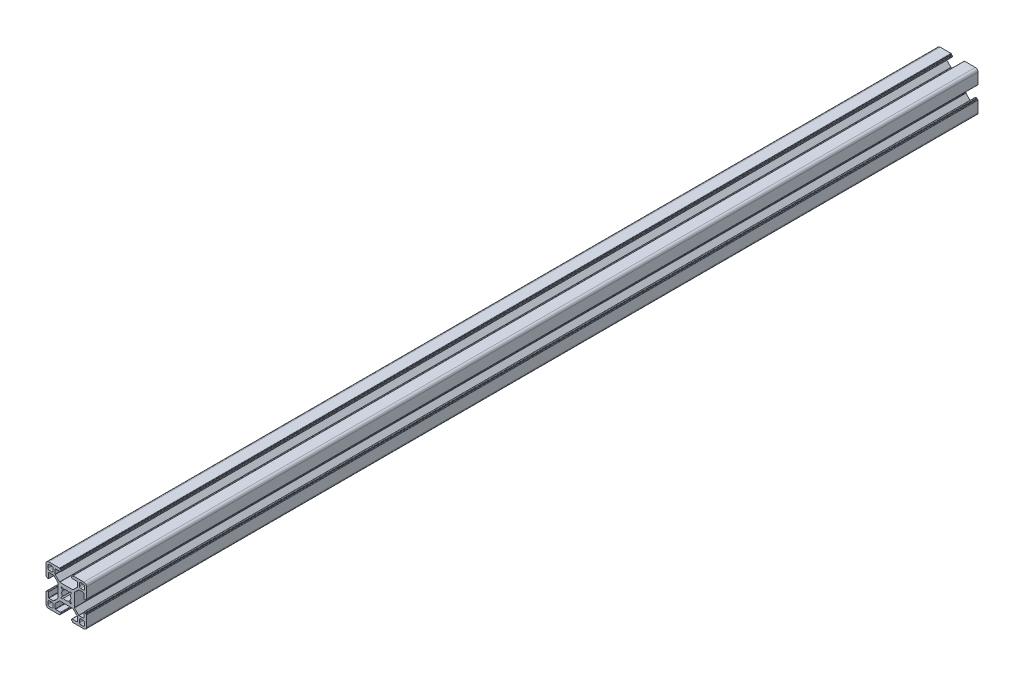
from build123d import *

# Parameters (mm, degrees)
ESTRUSIONE_ESTRUSIONE1_DEPTH = 660


with BuildPart() as part:
    # Schizzo1 → Estrusione-Estrusione1 (new body)
    with BuildSketch(Plane.XY.offset(25)):
        with BuildLine():
            Line((-4.7, -14.7), (-4.7, -14.6))
            ThreePointArc((-4.7, -14.6), (-4.612132034, -14.387867966), (-4.4, -14.3))
            Line((-4.4, -14.3), (-4.3, -14.3))
            ThreePointArc((-4.3, -14.3), (-4.087867966, -14.212132034), (-4, -14))
            Line((-4, -14), (-4, -13.3))
            ThreePointArc((-4, -13.3), (-4.087867966, -13.087867966), (-4.3, -13))
            Line((-4.3, -13), (-7.95, -13))
            ThreePointArc((-7.95, -13), (-8.162132034, -12.912132034), (-8.25, -12.7))
            Line((-8.25, -12.7), (-8.25, -9.43492424))
            ThreePointArc((-8.25, -9.43492424), (-8.22716386, -9.320119211), (-8.162132034, -9.222792206))
            Line((-8.162132034, -9.222792206), (-5.027207794, -6.087867966))
            ThreePointArc((-5.027207794, -6.087867966), (-4.929880789, -6.02283614), (-4.81507576, -6))
            Line((-4.81507576, -6), (4.81507576, -6))
            ThreePointArc((4.81507576, -6), (4.929880789, -6.02283614), (5.027207794, -6.087867966))
            Line((5.027207794, -6.087867966), (8.162132034, -9.222792206))
            ThreePointArc((8.162132034, -9.222792206), (8.22716386, -9.320119211), (8.25, -9.43492424))
            Line((8.25, -9.43492424), (8.25, -12.7))
            ThreePointArc((8.25, -12.7), (8.162132034, -12.912132034), (7.95, -13))
            Line((7.95, -13), (4.3, -13))
            ThreePointArc((4.3, -13), (4.087867966, -13.087867966), (4, -13.3))
            Line((4, -13.3), (4, -14))
            ThreePointArc((4, -14), (4.087867966, -14.212132034), (4.3, -14.3))
            Line((4.3, -14.3), (4.4, -14.3))
            ThreePointArc((4.4, -14.3), (4.612132034, -14.387867966), (4.7, -14.6))
            Line((4.7, -14.6), (4.7, -14.7))
            ThreePointArc((4.7, -14.7), (4.787867966, -14.912132034), (5, -15))
            Line((5, -15), (13, -15))
            ThreePointArc((13, -15), (14.414213562, -14.414213562), (15, -13))
            Line((15, -13), (15, -5))
            ThreePointArc((15, -5), (14.912132034, -4.787867966), (14.7, -4.7))
            Line((14.7, -4.7), (14.6, -4.7))
            ThreePointArc((14.6, -4.7), (14.387867966, -4.612132034), (14.3, -4.4))
            Line((14.3, -4.4), (14.3, -4.3))
            ThreePointArc((14.3, -4.3), (14.212132034, -4.087867966), (14, -4))
            Line((14, -4), (13.3, -4))
            ThreePointArc((13.3, -4), (13.087867966, -4.087867966), (13, -4.3))
            Line((13, -4.3), (13, -7.95))
            ThreePointArc((13, -7.95), (12.912132034, -8.162132034), (12.7, -8.25))
            Line((12.7, -8.25), (9.43492424, -8.25))
            ThreePointArc((9.43492424, -8.25), (9.320119211, -8.22716386), (9.222792206, -8.162132034))
            Line((9.222792206, -8.162132034), (6.087867966, -5.027207794))
            ThreePointArc((6.087867966, -5.027207794), (6.02283614, -4.929880789), (6, -4.81507576))
            Line((6, -4.81507576), (6, 4.81507576))
            ThreePointArc((6, 4.81507576), (6.02283614, 4.929880789), (6.087867966, 5.027207794))
            Line((6.087867966, 5.027207794), (9.222792206, 8.162132034))
            ThreePointArc((9.222792206, 8.162132034), (9.320119211, 8.22716386), (9.43492424, 8.25))
            Line((9.43492424, 8.25), (12.7, 8.25))
            ThreePointArc((12.7, 8.25), (12.912132034, 8.162132034), (13, 7.95))
            Line((13, 7.95), (13, 4.3))
            ThreePointArc((13, 4.3), (13.087867966, 4.087867966), (13.3, 4))
            Line((13.3, 4), (14, 4))
            ThreePointArc((14, 4), (14.212132034, 4.087867966), (14.3, 4.3))
            Line((14.3, 4.3), (14.3, 4.4))
            ThreePointArc((14.3, 4.4), (14.387867966, 4.612132034), (14.6, 4.7))
            Line((14.6, 4.7), (14.7, 4.7))
            ThreePointArc((14.7, 4.7), (14.912132034, 4.787867966), (15, 5))
            Line((15, 5), (15, 13))
            ThreePointArc((15, 13), (14.414213562, 14.414213562), (13, 15))
            Line((13, 15), (5, 15))
            ThreePointArc((5, 15), (4.787867966, 14.912132034), (4.7, 14.7))
            Line((4.7, 14.7), (4.7, 14.6))
            ThreePointArc((4.7, 14.6), (4.612132034, 14.387867966), (4.4, 14.3))
            Line((4.4, 14.3), (4.3, 14.3))
            ThreePointArc((4.3, 14.3), (4.087867966, 14.212132034), (4, 14))
            Line((4, 14), (4, 13.3))
            ThreePointArc((4, 13.3), (4.087867966, 13.087867966), (4.3, 13))
            Line((4.3, 13), (7.95, 13))
            ThreePointArc((7.95, 13), (8.162132034, 12.912132034), (8.25, 12.7))
            Line((8.25, 12.7), (8.25, 9.43492424))
            ThreePointArc((8.25, 9.43492424), (8.22716386, 9.320119211), (8.162132034, 9.222792206))
            Line((8.162132034, 9.222792206), (5.027207794, 6.087867966))
            ThreePointArc((5.027207794, 6.087867966), (4.929880789, 6.02283614), (4.81507576, 6))
            Line((4.81507576, 6), (-4.81507576, 6))
            ThreePointArc((-4.81507576, 6), (-4.929880789, 6.02283614), (-5.027207794, 6.087867966))
            Line((-5.027207794, 6.087867966), (-8.162132034, 9.222792206))
            ThreePointArc((-8.162132034, 9.222792206), (-8.22716386, 9.320119211), (-8.25, 9.43492424))
            Line((-8.25, 9.43492424), (-8.25, 12.7))
            ThreePointArc((-8.25, 12.7), (-8.162132034, 12.912132034), (-7.95, 13))
            Line((-7.95, 13), (-4.3, 13))
            ThreePointArc((-4.3, 13), (-4.087867966, 13.087867966), (-4, 13.3))
            Line((-4, 13.3), (-4, 14))
            ThreePointArc((-4, 14), (-4.087867966, 14.212132034), (-4.3, 14.3))
            Line((-4.3, 14.3), (-4.4, 14.3))
            ThreePointArc((-4.4, 14.3), (-4.612132034, 14.387867966), (-4.7, 14.6))
            Line((-4.7, 14.6), (-4.7, 14.7))
            ThreePointArc((-4.7, 14.7), (-4.787867966, 14.912132034), (-5, 15))
            Line((-5, 15), (-13, 15))
            ThreePointArc((-13, 15), (-14.414213562, 14.414213562), (-15, 13))
            Line((-15, 13), (-15, 5))
            ThreePointArc((-15, 5), (-14.912132034, 4.787867966), (-14.7, 4.7))
            Line((-14.7, 4.7), (-14.6, 4.7))
            ThreePointArc((-14.6, 4.7), (-14.387867966, 4.612132034), (-14.3, 4.4))
            Line((-14.3, 4.4), (-14.3, 4.3))
            ThreePointArc((-14.3, 4.3), (-14.212132034, 4.087867966), (-14, 4))
            Line((-14, 4), (-13.3, 4))
            ThreePointArc((-13.3, 4), (-13.087867966, 4.087867966), (-13, 4.3))
            Line((-13, 4.3), (-13, 7.95))
            ThreePointArc((-13, 7.95), (-12.912132034, 8.162132034), (-12.7, 8.25))
            Line((-12.7, 8.25), (-9.43492424, 8.25))
            ThreePointArc((-9.43492424, 8.25), (-9.320119211, 8.22716386), (-9.222792206, 8.162132034))
            Line((-9.222792206, 8.162132034), (-6.087867966, 5.027207794))
            ThreePointArc((-6.087867966, 5.027207794), (-6.02283614, 4.929880789), (-6, 4.81507576))
            Line((-6, 4.81507576), (-6, -4.81507576))
            ThreePointArc((-6, -4.81507576), (-6.02283614, -4.929880789), (-6.087867966, -5.027207794))
            Line((-6.087867966, -5.027207794), (-9.222792206, -8.162132034))
            ThreePointArc((-9.222792206, -8.162132034), (-9.320119211, -8.22716386), (-9.43492424, -8.25))
            Line((-9.43492424, -8.25), (-12.7, -8.25))
            ThreePointArc((-12.7, -8.25), (-12.912132034, -8.162132034), (-13, -7.95))
            Line((-13, -7.95), (-13, -4.3))
            ThreePointArc((-13, -4.3), (-13.087867966, -4.087867966), (-13.3, -4))
            Line((-13.3, -4), (-14, -4))
            ThreePointArc((-14, -4), (-14.212132034, -4.087867966), (-14.3, -4.3))
            Line((-14.3, -4.3), (-14.3, -4.4))
            ThreePointArc((-14.3, -4.4), (-14.387867966, -4.612132034), (-14.6, -4.7))
            Line((-14.6, -4.7), (-14.7, -4.7))
            ThreePointArc((-14.7, -4.7), (-14.912132034, -4.787867966), (-15, -5))
            Line((-15, -5), (-15, -13))
            ThreePointArc((-15, -13), (-14.414213562, -14.414213562), (-13, -15))
            Line((-13, -15), (-5, -15))
            ThreePointArc((-5, -15), (-4.787867966, -14.912132034), (-4.7, -14.7))
        make_face()
        with BuildLine():
            Line((-12.5625, -9.75), (-10.6875, -9.75))
            ThreePointArc((-10.6875, -9.75), (-10.024587393, -10.024587393), (-9.75, -10.6875))
            Line((-9.75, -10.6875), (-9.75, -12.5625))
            ThreePointArc((-9.75, -12.5625), (-10.024587393, -13.225412607), (-10.6875, -13.5))
            Line((-10.6875, -13.5), (-12.5625, -13.5))
            ThreePointArc((-12.5625, -13.5), (-13.225412607, -13.225412607), (-13.5, -12.5625))
            Line((-13.5, -12.5625), (-13.5, -10.6875))
            ThreePointArc((-13.5, -10.6875), (-13.225412607, -10.024587393), (-12.5625, -9.75))
        make_face(mode=Mode.SUBTRACT)
        with BuildLine():
            Line((12.5625, 9.75), (10.6875, 9.75))
            ThreePointArc((10.6875, 9.75), (10.024587393, 10.024587393), (9.75, 10.6875))
            Line((9.75, 10.6875), (9.75, 12.5625))
            ThreePointArc((9.75, 12.5625), (10.024587393, 13.225412607), (10.6875, 13.5))
            Line((10.6875, 13.5), (12.5625, 13.5))
            ThreePointArc((12.5625, 13.5), (13.225412607, 13.225412607), (13.5, 12.5625))
            Line((13.5, 12.5625), (13.5, 10.6875))
            ThreePointArc((13.5, 10.6875), (13.225412607, 10.024587393), (12.5625, 9.75))
        make_face(mode=Mode.SUBTRACT)
        with BuildLine():
            Line((2.010111251, 2.742162059), (2.867949192, 3.6))
            ThreePointArc((2.867949192, 3.6), (3.6, 3.6), (3.6, 2.867949192))
            Line((3.6, 2.867949192), (2.742162059, 2.010111251))
            ThreePointArc((2.742162059, 2.010111251), (3.4, 0), (2.742162059, -2.010111251))
            Line((2.742162059, -2.010111251), (3.6, -2.867949192))
            ThreePointArc((3.6, -2.867949192), (3.6, -3.6), (2.867949192, -3.6))
            Line((2.867949192, -3.6), (2.010111251, -2.742162059))
            ThreePointArc((2.010111251, -2.742162059), (0, -3.4), (-2.010111251, -2.742162059))
            Line((-2.010111251, -2.742162059), (-2.867949192, -3.6))
            ThreePointArc((-2.867949192, -3.6), (-3.6, -3.6), (-3.6, -2.867949192))
            Line((-3.6, -2.867949192), (-2.742162059, -2.010111251))
            ThreePointArc((-2.742162059, -2.010111251), (-3.4, 0), (-2.742162059, 2.010111251))
            Line((-2.742162059, 2.010111251), (-3.6, 2.867949192))
            ThreePointArc((-3.6, 2.867949192), (-3.6, 3.6), (-2.867949192, 3.6))
            Line((-2.867949192, 3.6), (-2.010111251, 2.742162059))
            ThreePointArc((-2.010111251, 2.742162059), (0, 3.4), (2.010111251, 2.742162059))
        make_face(mode=Mode.SUBTRACT)
        with BuildLine():
            Line((-9.75, 12.5625), (-9.75, 10.6875))
            ThreePointArc((-9.75, 10.6875), (-10.024587393, 10.024587393), (-10.6875, 9.75))
            Line((-10.6875, 9.75), (-12.5625, 9.75))
            ThreePointArc((-12.5625, 9.75), (-13.225412607, 10.024587393), (-13.5, 10.6875))
            Line((-13.5, 10.6875), (-13.5, 12.5625))
            ThreePointArc((-13.5, 12.5625), (-13.225412607, 13.225412607), (-12.5625, 13.5))
            Line((-12.5625, 13.5), (-10.6875, 13.5))
            ThreePointArc((-10.6875, 13.5), (-10.024587393, 13.225412607), (-9.75, 12.5625))
        make_face(mode=Mode.SUBTRACT)
        with BuildLine():
            Line((9.75, -12.5625), (9.75, -10.6875))
            ThreePointArc((9.75, -10.6875), (10.024587393, -10.024587393), (10.6875, -9.75))
            Line((10.6875, -9.75), (12.5625, -9.75))
            ThreePointArc((12.5625, -9.75), (13.225412607, -10.024587393), (13.5, -10.6875))
            Line((13.5, -10.6875), (13.5, -12.5625))
            ThreePointArc((13.5, -12.5625), (13.225412607, -13.225412607), (12.5625, -13.5))
            Line((12.5625, -13.5), (10.6875, -13.5))
            ThreePointArc((10.6875, -13.5), (10.024587393, -13.225412607), (9.75, -12.5625))
        make_face(mode=Mode.SUBTRACT)
    extrude(amount=-ESTRUSIONE_ESTRUSIONE1_DEPTH)


solid = part.part
